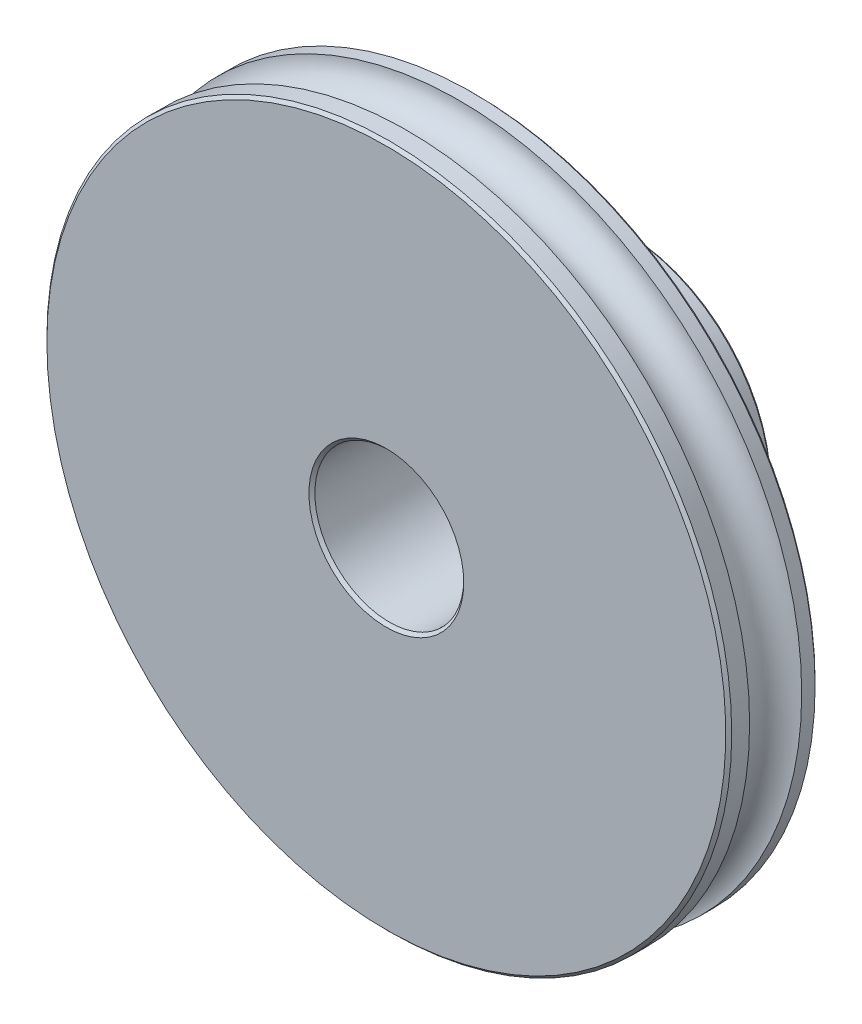
from build123d import *

# Parameters (mm, degrees)
SKETCH_2_W               = 2
SKETCH_2_H               = 31.418584287
PATTERN_CIRCULAR_1_COUNT = 2
PATTERN_CIRCULAR_1_ANGLE = 120
CHAMFER_1_SIZE           = 0.2
CHAMFER_2_SIZE           = 0.5


with BuildPart() as part:
    # 草图1 → 旋转1 (revolve)
    with BuildSketch(Plane(origin=(0, 0, 0), x_dir=(0, 0, -1), z_dir=(1, 0, 0)), mode=Mode.PRIVATE) as revolve_1_sk:
        with BuildLine():
            Line((0.861588836, 5), (16.861588836, 5))
            Line((16.861588836, 5), (16.861588836, 10))
            Line((16.861588836, 10), (6.861588836, 10))
            Line((6.861588836, 10), (6.861588836, 23))
            Line((6.861588836, 23), (5.761588836, 23))
            ThreePointArc((5.761588836, 23), (4.011588836, 21.25), (2.261588836, 23))
            Line((2.261588836, 23), (0.861588836, 23))
            Line((0.861588836, 23), (0.861588836, 5))
        make_face()
    revolve(revolve_1_sk.sketch.rotate(Axis((0, 0, 0), (0, 0, -1)), 90), axis=Axis((0, 0, 0), (0, 0, -1)))

    # 草图2 → M4 螺纹孔1 (revolve, cut)
    with BuildSketch(Plane(origin=(0, 0, -12), x_dir=(0, 0, -1), z_dir=(1, 0, 0))):
        with Locations((1, 15.709292144)):
            Rectangle(SKETCH_2_W, SKETCH_2_H)
    hole_wizard_m4_1 = revolve(axis=Axis((0, -6.35, -12), (0, 1, 0)), mode=Mode.SUBTRACT)

    # 阵列(圆周)1: M4 螺纹孔1 ×2 about axis
    pattern_circular_1_axis = Axis((0, 0, 0), (0, 0, 1))
    for i in range(1, PATTERN_CIRCULAR_1_COUNT):
        add(hole_wizard_m4_1.rotate(pattern_circular_1_axis, i * PATTERN_CIRCULAR_1_ANGLE / (PATTERN_CIRCULAR_1_COUNT - 1)), mode=Mode.SUBTRACT)

    # 倒角1
    chamfer_1_edges = [part.edges().sort_by_distance(p)[0] for p in [
        (-23, 0, -0.861588836),
        (-23, 0, -6.861588836),
        (-10, 0, -16.861588836),
        (-5, 0, -16.861588836),
        (-5, 0, -0.861588836),
    ]]
    chamfer(chamfer_1_edges, length=CHAMFER_1_SIZE)

    # 倒角2
    chamfer_2_edges = [part.edges().sort_by_distance(p)[0] for p in [
        (-10, 0, -6.861588836),
    ]]
    chamfer(chamfer_2_edges, length=CHAMFER_2_SIZE)


solid = part.part
